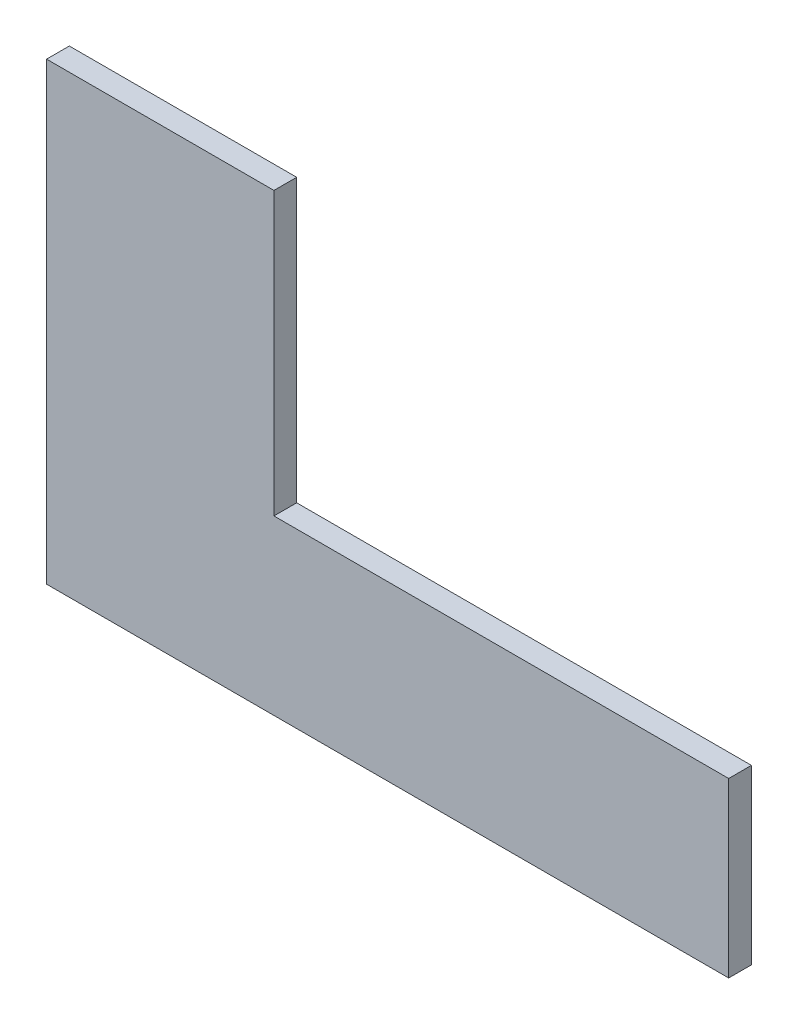
from build123d import *

# Parameters (mm, degrees)
BOSS_EXTRUDE1_DEPTH = 5


with BuildPart() as part:
    # Sketch1 → Boss-Extrude1 (new body)
    with BuildSketch(Plane.XY):
        Polygon((-86.893306639, 50.459013366), (-36.893306639, 50.459013366), (-36.893306639, -11.540986634), (63.106693361, -11.540986634), (63.106693361, -49.540986634), (-86.893306639, -49.540986634), align=None)
    extrude(amount=BOSS_EXTRUDE1_DEPTH)


solid = part.part
